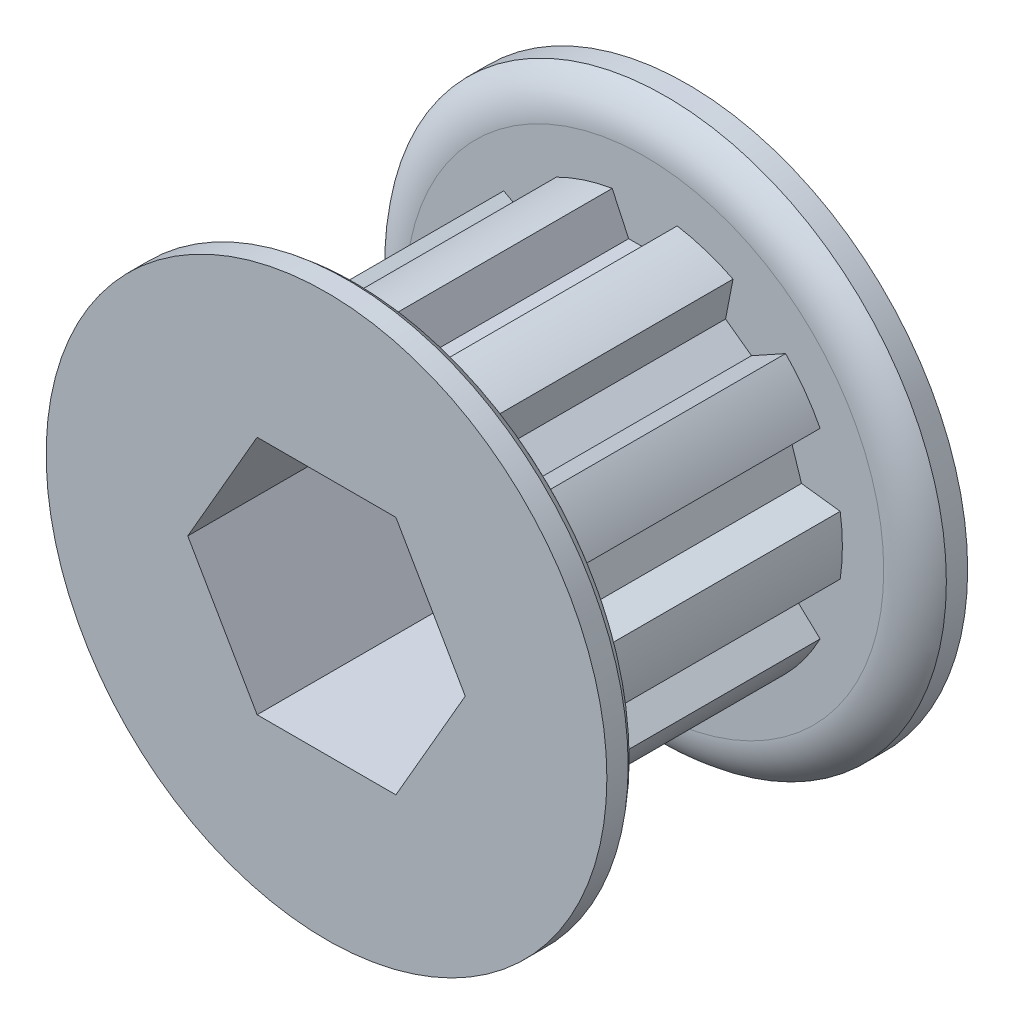
from build123d import *

# Parameters (mm, degrees)
CUT_EXTRUDE1_START = 2.2987
CUT_EXTRUDE1_DEPTH = 10.922
CIRPATTERN1_COUNT  = 10
CUT_EXTRUDE2_DEPTH = 25.654


with BuildPart() as part:
    # Sketch2 → Revolve1 (revolve)
    with BuildSketch(Plane(origin=(0, 0, 0), x_dir=(0, 0, -1), z_dir=(1, 0, 0)), mode=Mode.PRIVATE) as revolve1_sk:
        with BuildLine():
            Line((-3.9878, 2.5), (10.3124, 2.5))
            Line((10.3124, 2.5), (10.3124, 11.1125))
            Line((10.3124, 11.1125), (9.46785, 11.1125))
            ThreePointArc((9.46785, 11.1125), (8.846862309, 10.395787163), (8.6233, 9.4742))
            Line((8.6233, 9.4742), (8.6233, 7.8359))
            Line((8.6233, 7.8359), (-2.2987, 7.8359))
            Line((-2.2987, 7.8359), (-2.2987, 9.4742))
            ThreePointArc((-2.2987, 9.4742), (-2.522262309, 10.395787163), (-3.14325, 11.1125))
            Line((-3.14325, 11.1125), (-3.9878, 11.1125))
            Line((-3.9878, 11.1125), (-3.9878, 2.5))
        make_face()
    revolve(revolve1_sk.sketch.rotate(Axis((0, 0, 10.3124), (0, 0, -1)), 90), axis=Axis((0, 0, 10.3124), (0, 0, -1)))

    # Sketch3 → Cut-Extrude1 (cut)
    with BuildSketch(Plane.XY.offset(CUT_EXTRUDE1_START)):
        with BuildLine():
            Line((-0.635, 6.329348022), (0.635, 6.329348022))
            Line((0.635, 6.329348022), (1.287830721, 7.729348022))
            ThreePointArc((1.287830721, 7.729348022), (0, 7.8359), (-1.287830721, 7.729348022))
            Line((-1.287830721, 7.729348022), (-0.635, 6.329348022))
        make_face()
    cut_extrude1 = extrude(amount=-CUT_EXTRUDE1_DEPTH, mode=Mode.SUBTRACT)

    # CirPattern1: Cut-Extrude1 ×10 about axis
    cirpattern1_axis = Axis((0, 0, 0), (0, 0, 1))
    for i in range(1, CIRPATTERN1_COUNT):
        add(cut_extrude1.rotate(cirpattern1_axis, i * 360 / CIRPATTERN1_COUNT), mode=Mode.SUBTRACT)

    # Sketch6 → Cut-Extrude2 (cut)
    with BuildSketch(Plane(origin=(0, 0, -10.3124), x_dir=(-1, 0, 0), z_dir=(0, 0, -1))):
        Polygon((5.499261314, 0), (2.749630657, 4.7625), (-2.749630657, 4.7625), (-5.499261314, 0), (-2.749630657, -4.7625), (2.749630657, -4.7625), align=None)
    extrude(amount=-CUT_EXTRUDE2_DEPTH, mode=Mode.SUBTRACT)


solid = part.part
